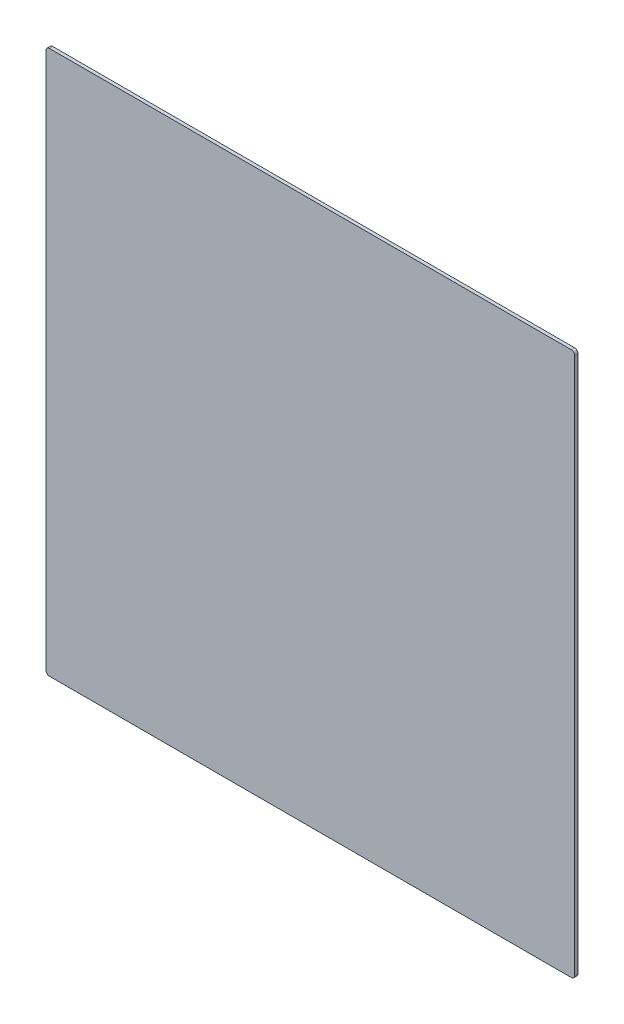
from build123d import *

# Parameters (mm, degrees)
BOSS_EXTRUDE1_DEPTH = 3.175


with BuildPart() as part:
    # Sketch1 → Boss-Extrude1 (new body)
    with BuildSketch(Plane.XY):
        with BuildLine():
            Line((-247.65, -257.96875), (247.65, -257.96875))
            ThreePointArc((247.65, -257.96875), (249.89506403, -257.03881403), (250.825, -254.79375))
            Line((250.825, -254.79375), (250.825, 254.79375))
            ThreePointArc((250.825, 254.79375), (249.89506403, 257.03881403), (247.65, 257.96875))
            Line((247.65, 257.96875), (-247.65, 257.96875))
            ThreePointArc((-247.65, 257.96875), (-249.89506403, 257.03881403), (-250.825, 254.79375))
            Line((-250.825, 254.79375), (-250.825, -254.79375))
            ThreePointArc((-250.825, -254.79375), (-249.89506403, -257.03881403), (-247.65, -257.96875))
        make_face()
    extrude(amount=BOSS_EXTRUDE1_DEPTH)


solid = part.part
